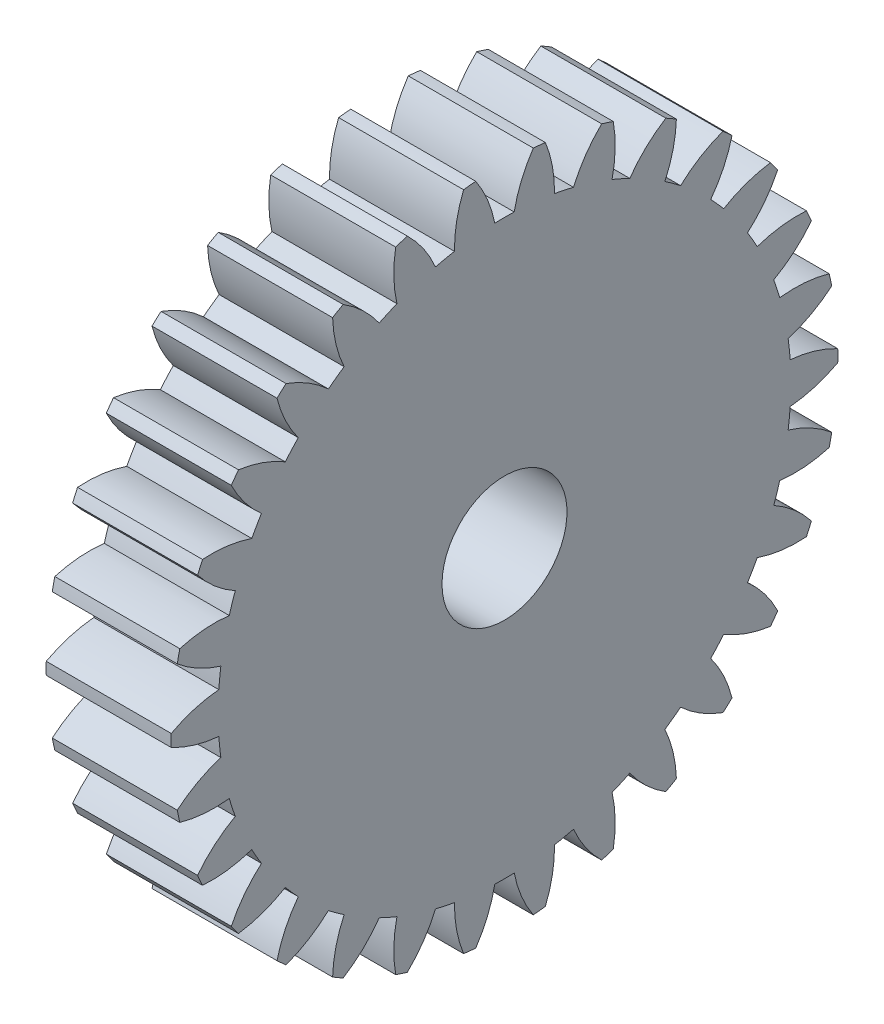
from build123d import *

# Parameters (mm, degrees)
BASPROSKE_W     = 3
BASPROSKE_H     = 8
TOOTHCUT_DEPTH  = 12.704699911
TEETHCUTS_COUNT = 30
TEETHCUTS_ANGLE = 348
BORSKE_R        = 1.5
BORE_DEPTH      = 50.0000508


with BuildPart() as part:
    # BasProSke → Base-Revolve (revolve)
    with BuildSketch(Plane(origin=(0, 0, 0), x_dir=(1, 0, 0), z_dir=(0, 1, 0)), mode=Mode.PRIVATE) as base_revolve_sk:
        with Locations((1.5, 4)):
            Rectangle(BASPROSKE_W, BASPROSKE_H)
    revolve(base_revolve_sk.sketch.rotate(Axis((-10, 0, 0), (1, 0, 0)), 180), axis=Axis((-10, 0, 0), (1, 0, 0)))

    # TooCutSke → ToothCut (cut, through all)
    with BuildSketch(Plane(origin=(0, 0, 0), x_dir=(0, 0, -1), z_dir=(1, 0, 0))):
        with BuildLine():
            ThreePointArc((0.233102578, 6.87004652), (0, 6.874), (-0.233102578, 6.87004652))
            ThreePointArc((-0.233102578, 6.87004652), (-0.41229689, 7.456465027), (-0.706981715, 7.994199273))
            ThreePointArc((-0.706981715, 7.994199273), (0, 8.0254), (0.706981715, 7.994199273))
            ThreePointArc((0.706981715, 7.994199273), (0.41229689, 7.456465027), (0.233102578, 6.87004652))
        make_face()
    toothcut = extrude(amount=TOOTHCUT_DEPTH, mode=Mode.SUBTRACT)

    # TeethCuts: ToothCut ×30 about axis
    teethcuts_axis = Axis((-10, 0, 0), (1, 0, 0))
    for i in range(1, TEETHCUTS_COUNT):
        add(toothcut.rotate(teethcuts_axis, i * TEETHCUTS_ANGLE / (TEETHCUTS_COUNT - 1)), mode=Mode.SUBTRACT)

    # BorSke → Bore (cut, symmetric)
    with BuildSketch(Plane(origin=(0, 0, 0), x_dir=(0, 0, -1), z_dir=(1, 0, 0))):
        with Locations(Location((0, 0, 0), (0, 0, 180))):
            Circle(BORSKE_R)
    extrude(amount=BORE_DEPTH, both=True, mode=Mode.SUBTRACT)


solid = part.part
